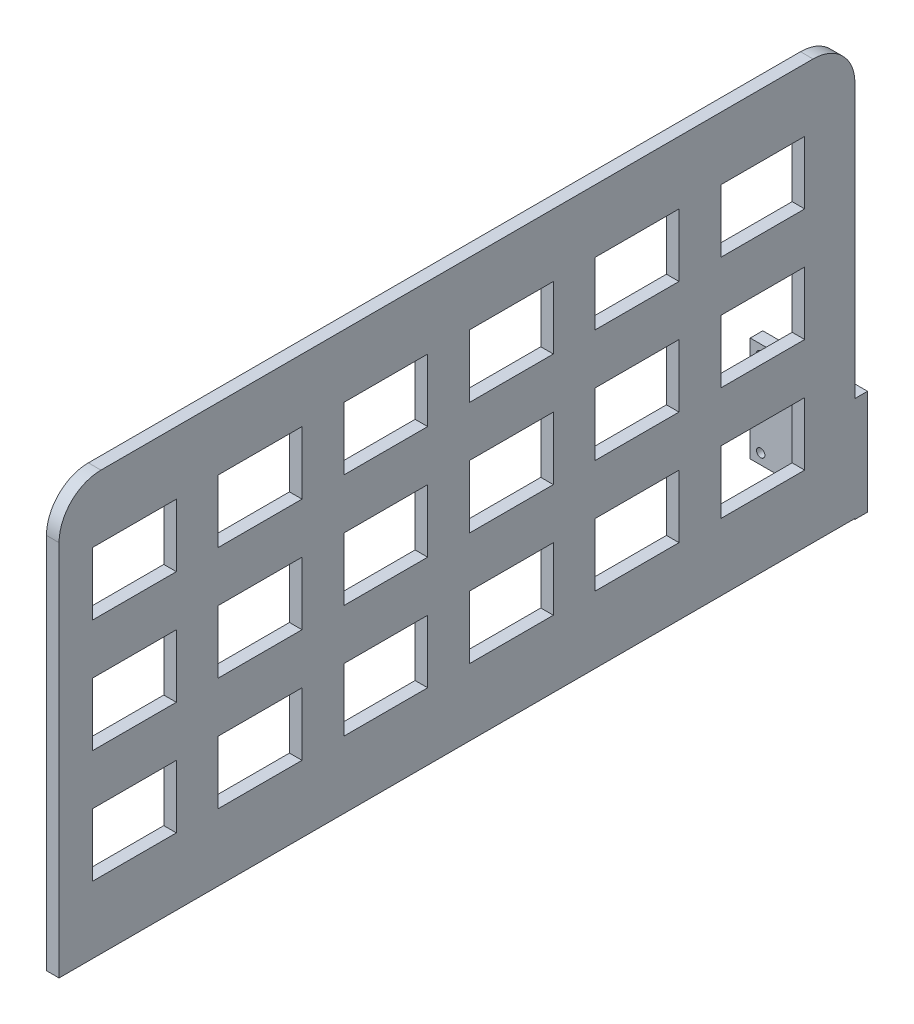
from build123d import *

# Parameters (mm, degrees)
SKETCH_1_W               = 25
SKETCH_1_H               = 25
EXTRUDE_1_DEPTH          = 3
SKETCH_2_W               = 3
SKETCH_2_H               = 100
EXTRUDE_2_DEPTH          = 190
FILLET_1_R               = 10
SKETCH_3_W               = 20
SKETCH_3_H               = 15
CUT_EXTRUDE_2_DEPTH      = 10
FILLET_2_R               = 10
FILLET_3_R               = 10
CUT_EXTRUDE_3_DEPTH      = 5
CUT_EXTRUDE_3_DEPTH_BACK = 5
SKETCH_4_R               = 1.05
SKETCH_4_R_2             = 1


with BuildPart() as part:
    # 草图1 → 凸台-拉伸1 (new body)
    with BuildSketch(Plane.XY):
        with Locations((-100.141216583, -61.148491789)):
            Rectangle(SKETCH_1_W, SKETCH_1_H)
    extrude(amount=EXTRUDE_1_DEPTH)

    # 草图2 → 凸台-拉伸2 (add)
    with BuildSketch(Plane.XY.offset(3)):
        with Locations((-89.141216583, -23.452816851)):
            Rectangle(SKETCH_2_W, SKETCH_2_H)
    extrude(amount=EXTRUDE_2_DEPTH)

    # 圆角1
    fillet_1_edges = [part.edges().sort_by_distance(p)[0] for p in [
        (-90.641216583, -61.05065432, 3),
    ]]
    fillet(fillet_1_edges, radius=FILLET_1_R)

    # 草图3 → 切除-拉伸2 (cut)
    with BuildSketch(Plane(origin=(-87.641216583, 0, 0), x_dir=(0, 0, -1), z_dir=(1, 0, 0))):
        with Locations((-25, 4.047183149)):
            Rectangle(SKETCH_3_W, SKETCH_3_H)
        with Locations((-55, 4.047183149)):
            Rectangle(SKETCH_3_W, SKETCH_3_H)
        with Locations((-85, 4.047183149)):
            Rectangle(SKETCH_3_W, SKETCH_3_H)
        with Locations((-115, 4.047183149)):
            Rectangle(SKETCH_3_W, SKETCH_3_H)
        with Locations((-145, 4.047183149)):
            Rectangle(SKETCH_3_W, SKETCH_3_H)
        with Locations((-175, 4.047183149)):
            Rectangle(SKETCH_3_W, SKETCH_3_H)
        with Locations((-55, -22.952816851)):
            Rectangle(SKETCH_3_W, SKETCH_3_H)
        with Locations((-85, -22.952816851)):
            Rectangle(SKETCH_3_W, SKETCH_3_H)
        with Locations((-115, -22.952816851)):
            Rectangle(SKETCH_3_W, SKETCH_3_H)
        with Locations((-145, -22.952816851)):
            Rectangle(SKETCH_3_W, SKETCH_3_H)
        with Locations((-175, -22.952816851)):
            Rectangle(SKETCH_3_W, SKETCH_3_H)
        with Locations((-55, -49.952816851)):
            Rectangle(SKETCH_3_W, SKETCH_3_H)
        with Locations((-85, -49.952816851)):
            Rectangle(SKETCH_3_W, SKETCH_3_H)
        with Locations((-115, -49.952816851)):
            Rectangle(SKETCH_3_W, SKETCH_3_H)
        with Locations((-145, -49.952816851)):
            Rectangle(SKETCH_3_W, SKETCH_3_H)
        with Locations((-175, -49.952816851)):
            Rectangle(SKETCH_3_W, SKETCH_3_H)
        with Locations((-25, -22.952816851)):
            Rectangle(SKETCH_3_W, SKETCH_3_H)
        with Locations((-25, -49.952816851)):
            Rectangle(SKETCH_3_W, SKETCH_3_H)
    extrude(amount=-CUT_EXTRUDE_2_DEPTH, mode=Mode.SUBTRACT)

    # 圆角2
    fillet_2_edges = [part.edges().sort_by_distance(p)[0] for p in [
        (-89.141216583, 26.547183149, 193),
    ]]
    fillet(fillet_2_edges, radius=FILLET_2_R)

    # 圆角3
    fillet_3_edges = [part.edges().sort_by_distance(p)[0] for p in [
        (-89.141216583, 26.547183149, 3),
    ]]
    fillet(fillet_3_edges, radius=FILLET_3_R)

    # 草图4 → 切除-拉伸3 (cut, two sides: drawn at the far end of the back side and taken through both)
    with BuildSketch(Plane.XY.offset(3).offset(-CUT_EXTRUDE_3_DEPTH_BACK)):
        with Locations((-110.141216583, -51.148491789)):
            Circle(SKETCH_4_R)
        with Locations((-110.141216583, -61.148491789)):
            Circle(SKETCH_4_R_2)
        with Locations((-110.141216583, -71.148491789)):
            Circle(SKETCH_4_R_2)
        with Locations(Location((-100.141216583, -71.148491789, 0), (0, 0, 239.999999998))):
            Circle(SKETCH_4_R_2)
        with Locations(Location((-100.141216583, -68.648491789, 0), (0, 0, 239.999999998))):
            Circle(SKETCH_4_R_2)
        with Locations(Location((-100.141216583, -51.148491789, 0), (0, 0, 239.999999998))):
            Circle(SKETCH_4_R_2)
        with Locations(Location((-100.141216583, -53.648491789, 0), (0, 0, 239.999999998))):
            Circle(SKETCH_4_R_2)
    extrude(amount=CUT_EXTRUDE_3_DEPTH + CUT_EXTRUDE_3_DEPTH_BACK, mode=Mode.SUBTRACT)


solid = part.part
